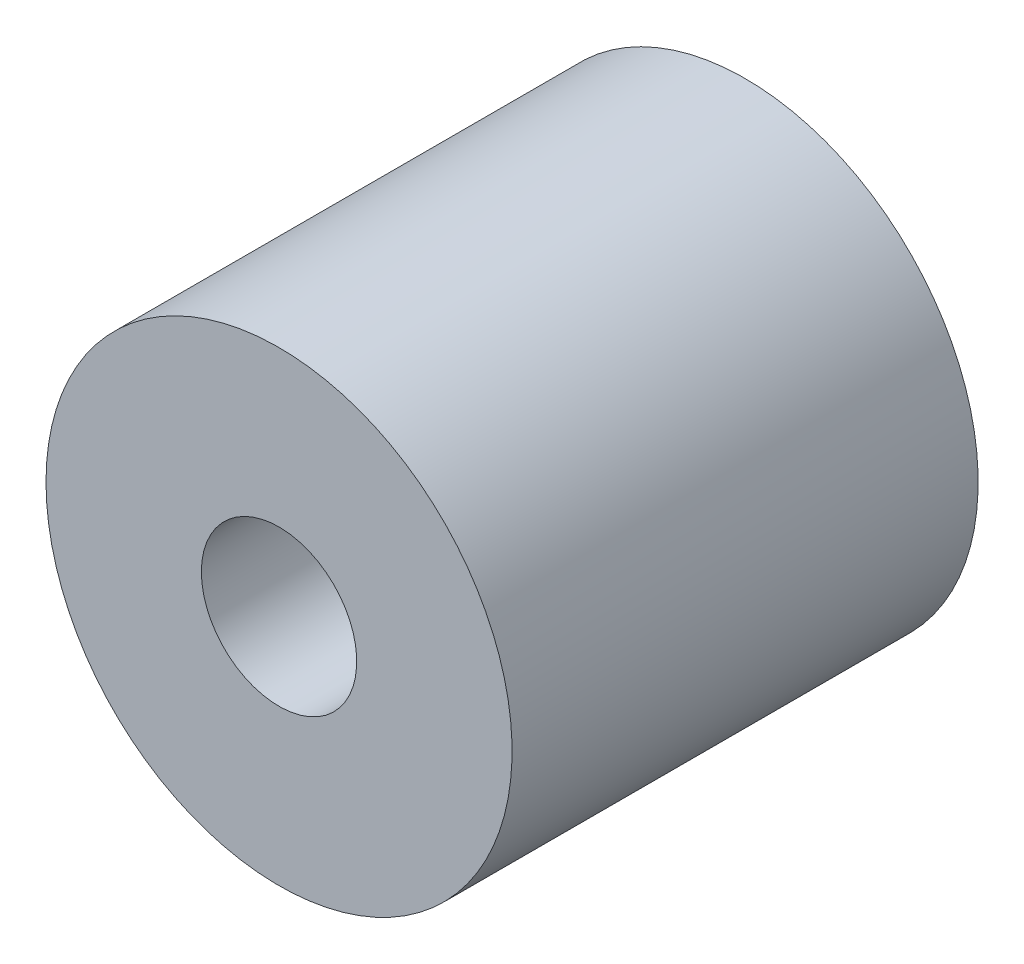
from build123d import *

# Parameters (mm, degrees)
ANNULUSPROFILE_W = 4
ANNULUSPROFILE_H = 12


with BuildPart() as part:
    # AnnulusProfile → Revolution (revolve)
    with BuildSketch(Plane(origin=(0, 0, 0), x_dir=(1, 0, 0), z_dir=(0, 1, 0)), mode=Mode.PRIVATE) as revolution_sk:
        with Locations((4, -6)):
            Rectangle(ANNULUSPROFILE_W, ANNULUSPROFILE_H)
    revolve(revolution_sk.sketch.rotate(Axis((0, 0, 0), (0, 0, 1)), 180), axis=Axis((0, 0, 0), (0, 0, 1)))


solid = part.part
